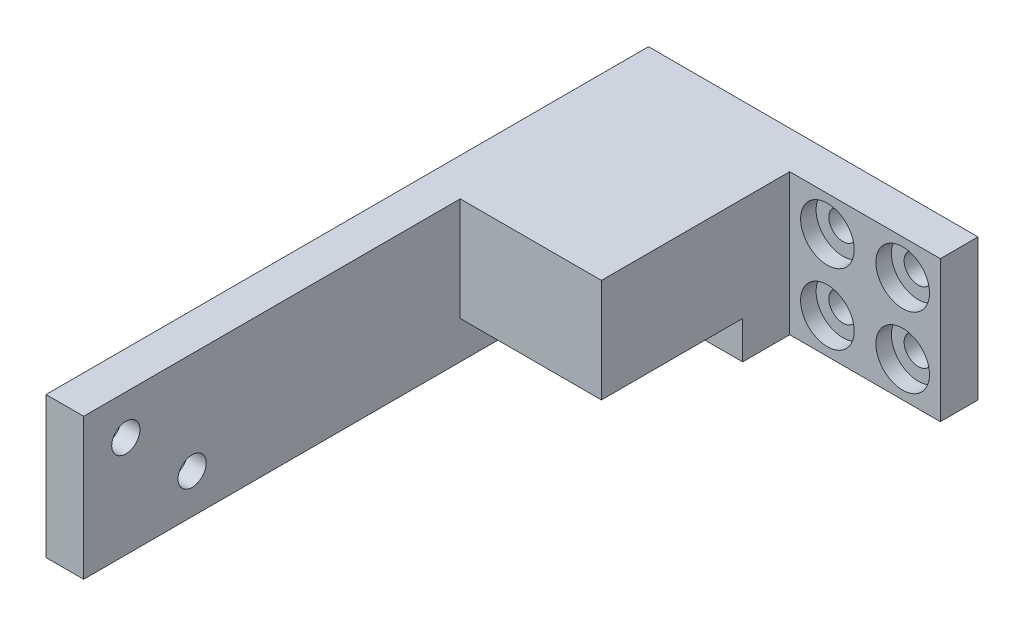
from build123d import *

# Parameters (mm, degrees)
CROQUIS1_W              = 15
CROQUIS1_H              = 15
CROQUIS1_W_2            = 4
CROQUIS1_W_3            = 16
CROQUIS1_R              = 1.5
SALIENTE_EXTRUIR1_DEPTH = 4
CROQUIS2_W              = 4
CROQUIS2_H              = 15
SALIENTE_EXTRUIR2_DEPTH = 60
CROQUIS3_W              = 15
CROQUIS3_H              = 15
SALIENTE_EXTRUIR3_DEPTH = 20
CROQUIS9_R              = 2.85
CORTAR_EXTRUIR3_DEPTH   = 1.65
CORTAR_EXTRUIR4_REACH   = 76.471
CROQUIS4_R              = 1.5
CROQUIS4_3_R            = 1.5
CORTAR_EXTRUIR5_DEPTH   = 2
CROQUIS10_W             = 15
CROQUIS10_H             = 15
CORTAR_EXTRUIR6_DEPTH   = 4
CROQUIS11_R             = 1.5
CORTAR_EXTRUIR7_DEPTH   = 6
CROQUIS12_R             = 2.75
CORTAR_EXTRUIR9_DEPTH   = 1


with BuildPart() as part:
    # Croquis1 → Saliente-Extruir1 (new body)
    # profile 1 of 3: a face of its own
    with BuildSketch(Plane.XY):
        with Locations((11.5, 7.5)):
            Rectangle(CROQUIS1_W, CROQUIS1_H)
    # profile 2 of 3: a face of its own
    with BuildSketch(Plane.XY):
        with Locations((2, 7.5)):
            Rectangle(CROQUIS1_W_2, CROQUIS1_H)
    # profile 3 of 3: a face of its own
    with BuildSketch(Plane.XY):
        with Locations((27, 7.5)):
            Rectangle(CROQUIS1_W_3, CROQUIS1_H)
        with Locations((23, 11.25)):
            Circle(CROQUIS1_R, mode=Mode.SUBTRACT)
        with Locations((31, 11.25)):
            Circle(CROQUIS1_R, mode=Mode.SUBTRACT)
        with Locations((31, 3.75)):
            Circle(CROQUIS1_R, mode=Mode.SUBTRACT)
        with Locations((23, 3.75)):
            Circle(CROQUIS1_R, mode=Mode.SUBTRACT)
    extrude(amount=SALIENTE_EXTRUIR1_DEPTH)

    # Croquis2 → Saliente-Extruir2 (add)
    with BuildSketch(Plane.XY.offset(4)):
        with Locations((2, 7.5)):
            Rectangle(CROQUIS2_W, CROQUIS2_H)
    extrude(amount=SALIENTE_EXTRUIR2_DEPTH)

    # Croquis3 → Saliente-Extruir3 (add)
    with BuildSketch(Plane.XY.offset(4)):
        with Locations((11.5, 7.5)):
            Rectangle(CROQUIS3_W, CROQUIS3_H)
    extrude(amount=SALIENTE_EXTRUIR3_DEPTH)

    # Croquis9 → Cortar-Extruir3 (cut)
    with BuildSketch(Plane.XY.offset(4)):
        with Locations((23, 3.75)):
            Circle(CROQUIS9_R)
        with Locations((31, 3.75)):
            Circle(CROQUIS9_R)
        with Locations((23, 11.25)):
            Circle(CROQUIS9_R)
        with Locations((31, 11.25)):
            Circle(CROQUIS9_R)
    extrude(amount=-CORTAR_EXTRUIR3_DEPTH, mode=Mode.SUBTRACT)

    # Croquis4 → Cortar-Extruir4 (cut, up to next)
    with BuildSketch(Plane(origin=(0, 0, 0), x_dir=(0, 0, -1), z_dir=(1, 0, 0)), mode=Mode.PRIVATE) as cortar_extruir4_sk1:
        with Locations(Location((-59.52, 10.8, 0), (0, 0, 180))):
            Circle(CROQUIS4_R)
    cortar_extruir4_tool1 = extrude(cortar_extruir4_sk1.sketch, amount=CORTAR_EXTRUIR4_REACH, mode=Mode.PRIVATE) & part.part
    # Croquis4 → Cortar-Extruir4 (cut, up to next)
    with BuildSketch(Plane(origin=(0, 0, 0), x_dir=(0, 0, -1), z_dir=(1, 0, 0)), mode=Mode.PRIVATE) as cortar_extruir4_sk2:
        with Locations(Location((-52.48, 4.2, 0), (0, 0, 180))):
            Circle(CROQUIS4_R)
    cortar_extruir4_tool2 = extrude(cortar_extruir4_sk2.sketch, amount=CORTAR_EXTRUIR4_REACH, mode=Mode.PRIVATE) & part.part
    add(cortar_extruir4_tool1.solids().sort_by_distance((0, 10.8, 59.52))[0], mode=Mode.SUBTRACT)
    add(cortar_extruir4_tool2.solids().sort_by_distance((0, 4.2, 52.48))[0], mode=Mode.SUBTRACT)

    # Croquis4<3> → Cortar-Extruir5 (cut)
    # profile 1 of 2: a face of its own
    with BuildSketch(Plane(origin=(0, 0, 0), x_dir=(0, 0, -1), z_dir=(1, 0, 0))):
        Polygon((-59.52, 13.975426481), (-62.27, 12.38771324), (-62.27, 9.21228676), (-59.52, 7.624573519), (-56.77, 9.21228676), (-56.77, 12.38771324), align=None)
        with Locations(Location((-59.52, 10.8, 0), (0, 0, 180))):
            Circle(CROQUIS4_3_R, mode=Mode.SUBTRACT)
    # profile 2 of 2: a face of its own
    with BuildSketch(Plane(origin=(0, 0, 0), x_dir=(0, 0, -1), z_dir=(1, 0, 0))):
        Polygon((-52.48, 7.375426481), (-55.23, 5.78771324), (-55.23, 2.61228676), (-52.48, 1.024573519), (-49.73, 2.61228676), (-49.73, 5.78771324), align=None)
        with Locations(Location((-52.48, 4.2, 0), (0, 0, 180))):
            Circle(CROQUIS4_3_R, mode=Mode.SUBTRACT)
    extrude(amount=CORTAR_EXTRUIR5_DEPTH, mode=Mode.SUBTRACT)

    # Croquis10 → Cortar-Extruir6 (cut)
    with BuildSketch(Plane(origin=(0, 0, 0), x_dir=(1, 0, 0), z_dir=(0, 1, 0))):
        with Locations((11.5, -16.5)):
            Rectangle(CROQUIS10_W, CROQUIS10_H)
    extrude(amount=CORTAR_EXTRUIR6_DEPTH, mode=Mode.SUBTRACT)

    # Croquis11 → Cortar-Extruir7 (cut)
    with BuildSketch(Plane(origin=(0, 4, 0), x_dir=(-1, 0, 0), z_dir=(0, -1, 0))):
        with Locations(Location((-8.2, -13.2, 0), (0, 0, 90))):
            Circle(CROQUIS11_R)
        with Locations(Location((-14.8, -19.8, 0), (0, 0, 90))):
            Circle(CROQUIS11_R)
    extrude(amount=-CORTAR_EXTRUIR7_DEPTH, mode=Mode.SUBTRACT)

    # Croquis12 → Cortar-Extruir9 (cut)
    with BuildSketch(Plane.XZ.offset(-4)):
        with Locations(Location((8.2, 13.2, 0), (0, 0, 270))):
            Circle(CROQUIS12_R)
        with Locations(Location((14.8, 19.8, 0), (0, 0, 270))):
            Circle(CROQUIS12_R)
    extrude(amount=-CORTAR_EXTRUIR9_DEPTH, mode=Mode.SUBTRACT)


solid = part.part
